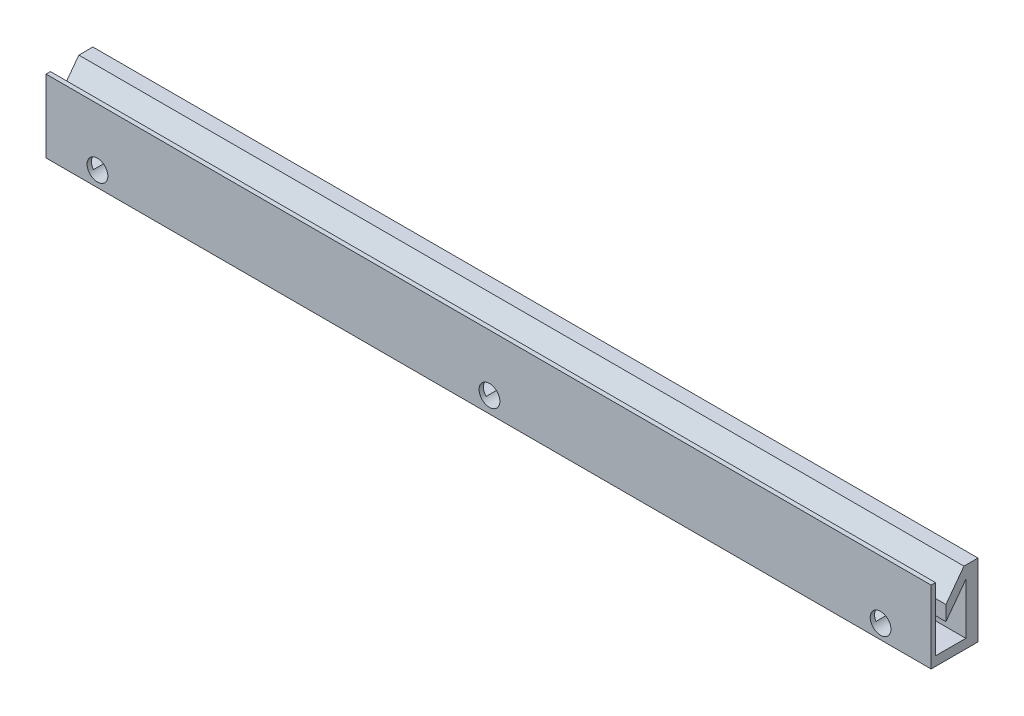
from build123d import *

# Parameters (mm, degrees)
BOSS_EXTRUDE1_DEPTH = 203.2
SKETCH2_R           = 2.38125
CUT_EXTRUDE1_DEPTH  = 205.198358087


with BuildPart() as part:
    # Sketch1 → Boss-Extrude1 (new body)
    with BuildSketch(Plane(origin=(0, 0, 0), x_dir=(0, 0, -1), z_dir=(1, 0, 0))):
        Polygon((0.083005599, 0.369350394), (0.083005599, 17.056692613), (1.083005599, 17.056692613), (1.083005599, 2.484301558), (8.052601156, 2.484301558), (8.052601156, 14.217769965), (3.483005599, 8.08145593), (3.483005599, 11.495503821), (7.624316401, 17.056692613), (10.84398523, 17.056692613), (10.84398523, 0.369350394), align=None)
    extrude(amount=BOSS_EXTRUDE1_DEPTH)

    # Sketch2 → Cut-Extrude1 (cut, through all)
    with BuildSketch(Plane.XY.offset(-0.083005599)):
        with Locations((11.814414866, 3.865442963)):
            Circle(SKETCH2_R)
        with Locations((191.596349419, 3.654678679)):
            Circle(SKETCH2_R)
        with Locations((101.810764284, 4.076207247)):
            Circle(SKETCH2_R)
    extrude(amount=-CUT_EXTRUDE1_DEPTH, mode=Mode.SUBTRACT)


solid = part.part
